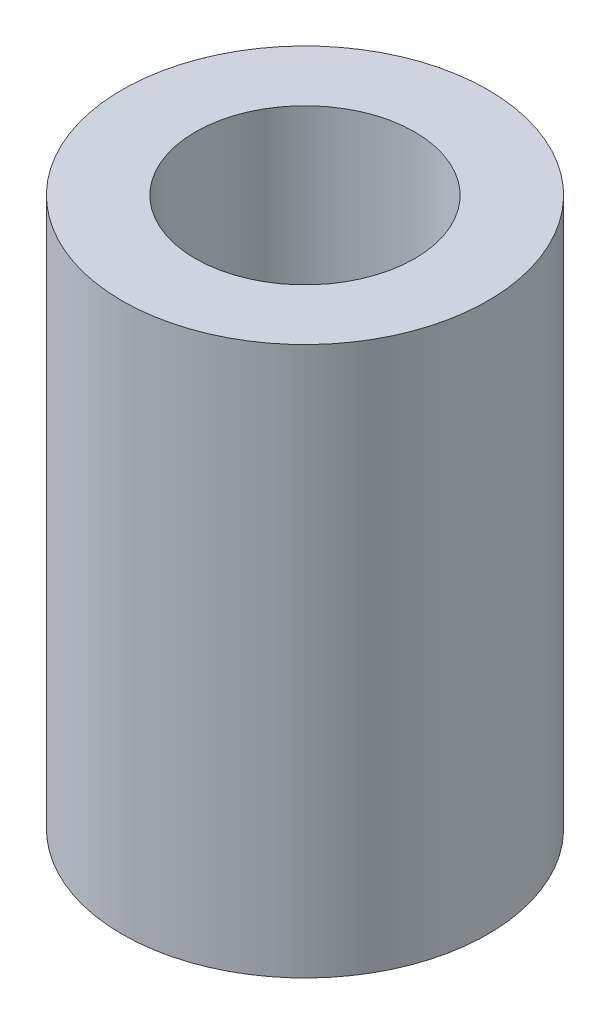
from build123d import *

# Parameters (mm, degrees)
SKETCH1_R           = 10
BOSS_EXTRUDE1_DEPTH = 30
SKETCH2_R           = 6
CUT_EXTRUDE1_DEPTH  = 10
SKETCH3_R           = 5
CUT_EXTRUDE2_DEPTH  = 10


with BuildPart() as part:
    # Sketch1 → Boss-Extrude1 (new body)
    with BuildSketch(Plane(origin=(0, 0, 0), x_dir=(1, 0, 0), z_dir=(0, 1, 0))):
        with Locations(Location((0, 0, 0), (0, 0, 270))):
            Circle(SKETCH1_R)
    extrude(amount=BOSS_EXTRUDE1_DEPTH)

    # Sketch2 → Cut-Extrude1 (cut)
    with BuildSketch(Plane(origin=(0, 30, 0), x_dir=(1, 0, 0), z_dir=(0, 1, 0))):
        with Locations(Location((0, 0, 0), (0, 0, 270))):
            Circle(SKETCH2_R)
    extrude(amount=-CUT_EXTRUDE1_DEPTH, mode=Mode.SUBTRACT)

    # Sketch3 → Cut-Extrude2 (cut)
    with BuildSketch(Plane.XZ):
        with Locations(Location((0, 0, 0), (0, 0, 270))):
            Circle(SKETCH3_R)
    extrude(amount=-CUT_EXTRUDE2_DEPTH, mode=Mode.SUBTRACT)


solid = part.part
